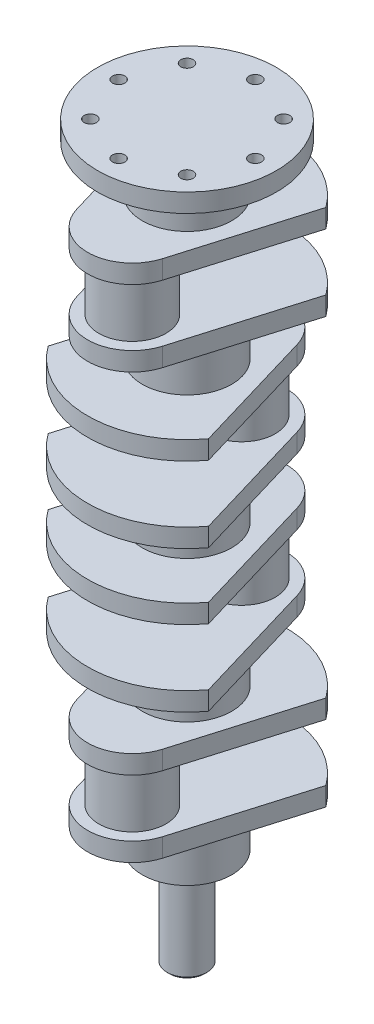
from build123d import *

# Parameters (mm, degrees)
SKETCH1_R              = 16
BOSS_EXTRUDE1_DEPTH    = 80
BOSS_EXTRUDE2_START    = 80
SKETCH1_3_R            = 36
SKETCH1_3_R_2          = 16
BOSS_EXTRUDE2_DEPTH    = 38
BOSS_EXTRUDE3_DEPTH    = 15
SKETCH2_3_R            = 27
BOSS_EXTRUDE4_DEPTH    = 61
LPATTERN1_COUNT        = 2
LPATTERN1_PITCH        = 61
SKETCH3_R              = 36
BOSS_EXTRUDE5_DEPTH    = 38
BOSS_EXTRUDE6_START    = 38
BOSS_EXTRUDE6_DEPTH    = 15
SKETCH6_R              = 27
BOSS_EXTRUDE8_DEPTH    = 46
LPATTERN3_COUNT        = 2
LPATTERN3_PITCH        = 61
LPATTERN5_COUNT        = 2
LPATTERN5_PITCH        = 114
LPATTERN5_START        = 38
LPATTERN5_COPY_1_DEPTH = 15
LPATTERN6_COUNT        = 2
LPATTERN6_PITCH        = 342
LPATTERN6_COPY_1_DEPTH = 15
SKETCH7_R              = 36
BOSS_EXTRUDE9_DEPTH    = 38
SKETCH8_R              = 72
SKETCH8_R_2            = 5
BOSS_EXTRUDE10_DEPTH   = 15
CHAMFER1_SIZE          = 2
FILLET1_R              = 3


with BuildPart() as part:
    # Sketch1 → Boss-Extrude1 (new body)
    with BuildSketch(Plane(origin=(0, 0, 0), x_dir=(1, 0, 0), z_dir=(0, 1, 0))):
        with Locations(Location((0, 0, 0), (0, 0, 270))):
            Circle(SKETCH1_R)
    extrude(amount=BOSS_EXTRUDE1_DEPTH)

    # Sketch1<3> → Boss-Extrude2 (add)
    # profile 1 of 2: a face of its own
    with BuildSketch(Plane(origin=(0, 0, 0), x_dir=(1, 0, 0), z_dir=(0, 1, 0)).offset(BOSS_EXTRUDE2_START)):
        with Locations(Location((0, 0, 0), (0, 0, 270))):
            Circle(SKETCH1_3_R)
        with Locations(Location((0, 0, 0), (0, 0, 270))):
            Circle(SKETCH1_3_R_2, mode=Mode.SUBTRACT)
    # profile 2 of 2: a face of its own
    with BuildSketch(Plane(origin=(0, 0, 0), x_dir=(1, 0, 0), z_dir=(0, 1, 0)).offset(BOSS_EXTRUDE2_START)):
        with Locations(Location((0, 0, 0), (0, 0, 270))):
            Circle(SKETCH1_3_R_2)
    boss_extrude2 = extrude(amount=BOSS_EXTRUDE2_DEPTH)

    # Sketch2 → Boss-Extrude3 (add)
    with BuildSketch(Plane(origin=(0, 118, 0), x_dir=(1, 0, 0), z_dir=(0, 1, 0))):
        with BuildLine():
            Line((-34.517510455, -54.224552409), (-64.569893475, 47.23059238))
            ThreePointArc((-64.569893475, 47.23059238), (0, 80), (64.569893475, 47.23059238))
            Line((64.569893475, 47.23059238), (34.517510455, -54.224552409))
            ThreePointArc((34.517510455, -54.224552409), (0, -80), (-34.517510455, -54.224552409))
        make_face()
    boss_extrude3 = extrude(amount=BOSS_EXTRUDE3_DEPTH)

    # Sketch2<3> → Boss-Extrude4 (add)
    with BuildSketch(Plane(origin=(0, 118, 0), x_dir=(1, 0, 0), z_dir=(0, 1, 0))):
        with Locations(Location((0, -44, 0), (0, 0, 90))):
            Circle(SKETCH2_3_R)
    boss_extrude4 = extrude(amount=BOSS_EXTRUDE4_DEPTH)

    # LPattern1: Boss-Extrude3 ×2
    with Locations(*[(0, i * LPATTERN1_PITCH, 0) for i in range(1, LPATTERN1_COUNT)]):
        add(boss_extrude3)

    # Sketch3 → Boss-Extrude5 (add)
    with BuildSketch(Plane(origin=(0, 194, 0), x_dir=(1, 0, 0), z_dir=(0, 1, 0))):
        with Locations(Location((0, 0, 0), (0, 0, 270))):
            Circle(SKETCH3_R)
    boss_extrude5 = extrude(amount=BOSS_EXTRUDE5_DEPTH)

    # Sketch5 → Boss-Extrude6 (add)
    with BuildSketch(Plane(origin=(0, 194, 0), x_dir=(1, 0, 0), z_dir=(0, 1, 0)).offset(BOSS_EXTRUDE6_START)):
        with BuildLine():
            Line((-34.517510455, 54.224552409), (-64.569893475, -47.23059238))
            ThreePointArc((-64.569893475, -47.23059238), (0, -80), (64.569893475, -47.23059238))
            Line((64.569893475, -47.23059238), (34.517510455, 54.224552409))
            ThreePointArc((34.517510455, 54.224552409), (0, 80), (-34.517510455, 54.224552409))
        make_face()
    boss_extrude6 = extrude(amount=BOSS_EXTRUDE6_DEPTH)

    # Sketch6 → Boss-Extrude8 (add)
    with BuildSketch(Plane(origin=(0, 247, 0), x_dir=(1, 0, 0), z_dir=(0, 1, 0))):
        with Locations(Location((0, 44, 0), (0, 0, 90))):
            Circle(SKETCH6_R)
    boss_extrude8 = extrude(amount=BOSS_EXTRUDE8_DEPTH)

    # LPattern3: Boss-Extrude6 ×2
    with Locations(*[(0, i * LPATTERN3_PITCH, 0) for i in range(1, LPATTERN3_COUNT)]):
        add(boss_extrude6)

    # LPattern5: Boss-Extrude5, Boss-Extrude6, Boss-Extrude8 ×2
    with Locations(*[(0, i * LPATTERN5_PITCH, 0) for i in range(1, LPATTERN5_COUNT)]):
        add(boss_extrude5)
        add(boss_extrude6)
        add(boss_extrude8)

    # LPattern5 copy 1 sketch → LPattern5 copy 1 (add)
    with BuildSketch(Plane(origin=(0, 369, 0), x_dir=(1, 0, 0), z_dir=(0, 1, 0)).offset(LPATTERN5_START)):
        with BuildLine():
            Line((-34.517510455, 54.224552409), (-64.569893475, -47.23059238))
            ThreePointArc((-64.569893475, -47.23059238), (0, -80), (64.569893475, -47.23059238))
            Line((64.569893475, -47.23059238), (34.517510455, 54.224552409))
            ThreePointArc((34.517510455, 54.224552409), (0, 80), (-34.517510455, 54.224552409))
        make_face()
    extrude(amount=LPATTERN5_COPY_1_DEPTH)

    # LPattern6: Boss-Extrude2, Boss-Extrude3, Boss-Extrude4 ×2
    with Locations(*[(0, i * LPATTERN6_PITCH, 0) for i in range(1, LPATTERN6_COUNT)]):
        add(boss_extrude2)
        add(boss_extrude3)
        add(boss_extrude4)

    # LPattern6 copy 1 sketch → LPattern6 copy 1 (add)
    with BuildSketch(Plane(origin=(0, 521, 0), x_dir=(1, 0, 0), z_dir=(0, 1, 0))):
        with BuildLine():
            Line((-34.517510455, -54.224552409), (-64.569893475, 47.23059238))
            ThreePointArc((-64.569893475, 47.23059238), (0, 80), (64.569893475, 47.23059238))
            Line((64.569893475, 47.23059238), (34.517510455, -54.224552409))
            ThreePointArc((34.517510455, -54.224552409), (0, -80), (-34.517510455, -54.224552409))
        make_face()
    extrude(amount=LPATTERN6_COPY_1_DEPTH)

    # Sketch7 → Boss-Extrude9 (add)
    with BuildSketch(Plane(origin=(0, 536, 0), x_dir=(1, 0, 0), z_dir=(0, 1, 0))):
        with Locations(Location((0, 0, 0), (0, 0, 270))):
            Circle(SKETCH7_R)
    extrude(amount=BOSS_EXTRUDE9_DEPTH)

    # Sketch8 → Boss-Extrude10 (add)
    with BuildSketch(Plane(origin=(0, 574, 0), x_dir=(1, 0, 0), z_dir=(0, 1, 0))):
        with Locations(Location((0, 0, 0), (0, 0, 270))):
            Circle(SKETCH8_R)
        with Locations(Location((0, 55, 0), (0, 0, 270))):
            Circle(SKETCH8_R_2, mode=Mode.SUBTRACT)
        with Locations(Location((38.890872965, 38.890872965, 0), (0, 0, 270))):
            Circle(SKETCH8_R_2, mode=Mode.SUBTRACT)
        with Locations(Location((55, 0, 0), (0, 0, 270))):
            Circle(SKETCH8_R_2, mode=Mode.SUBTRACT)
        with Locations(Location((38.890872965, -38.890872965, 0), (0, 0, 270))):
            Circle(SKETCH8_R_2, mode=Mode.SUBTRACT)
        with Locations(Location((0, -55, 0), (0, 0, 270))):
            Circle(SKETCH8_R_2, mode=Mode.SUBTRACT)
        with Locations(Location((-38.890872965, -38.890872965, 0), (0, 0, 270))):
            Circle(SKETCH8_R_2, mode=Mode.SUBTRACT)
        with Locations(Location((-55, 0, 0), (0, 0, 270))):
            Circle(SKETCH8_R_2, mode=Mode.SUBTRACT)
        with Locations(Location((-38.890872965, 38.890872965, 0), (0, 0, 270))):
            Circle(SKETCH8_R_2, mode=Mode.SUBTRACT)
    extrude(amount=BOSS_EXTRUDE10_DEPTH)

    # Chamfer1
    chamfer1_edges = [part.edges().sort_by_distance(p)[0] for p in [
        (0, 0, -16),
    ]]
    chamfer(chamfer1_edges, length=CHAMFER1_SIZE)

    # Fillet1
    fillet1_edges = [part.edges().sort_by_distance(p)[0] for p in [
        (0, 80, -16),
    ]]
    fillet(fillet1_edges, radius=FILLET1_R)


solid = part.part
